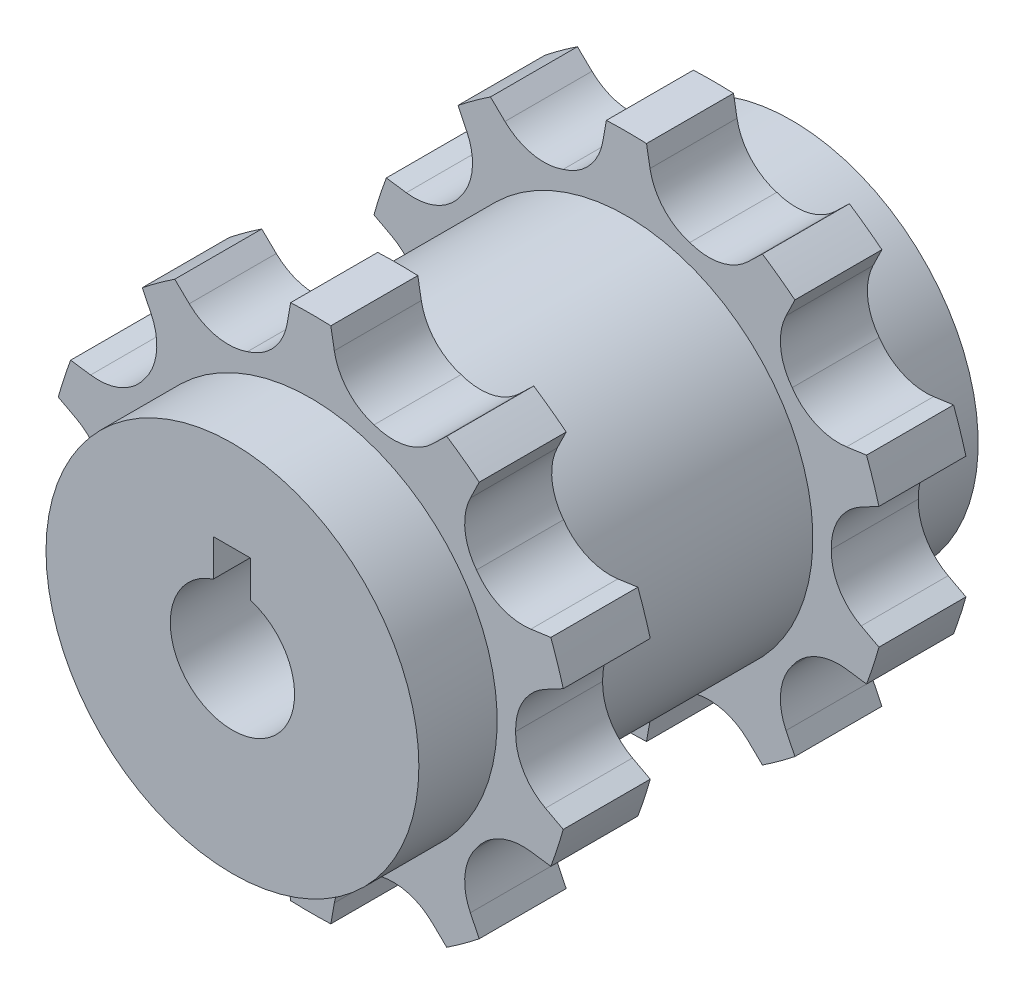
from build123d import *

# Parameters (mm, degrees)
EXTRUDE_1_DEPTH     = 7
SKETCH_2_R          = 15
EXTRUDE_2_DEPTH     = 18.4
EXTRUDE_3_DEPTH     = 7
EXTRUDE_START       = 6.3
SKETCH_4_R          = 15
EXTRUDE_4_DEPTH     = 6.3
SKETCH_5_R          = 15
EXTRUDE_5_DEPTH     = 6.3
CUT_EXTRUDE_1_DEPTH = 90.291681756


with BuildPart() as part:
    # 草图1 → 凸台-拉伸1 (new body)
    with BuildSketch(Plane.XY.offset(28.9)):
        with BuildLine():
            Line((42.411201909, 45.77806603), (42.129389286, 47.376304833))
            ThreePointArc((42.129389286, 47.376304833), (40.514502568, 47.409839327), (38.89961585, 47.376304833))
            Line((38.89961585, 47.376304833), (38.617803227, 45.77806603))
            ThreePointArc((38.617803227, 45.77806603), (37.528159676, 43.541003491), (35.420005537, 42.219088972))
            ThreePointArc((35.420005537, 42.219088972), (32.937471152, 42.04939837), (30.741018632, 43.218743572))
            Line((30.741018632, 43.218743572), (29.573606233, 44.346100621))
            ThreePointArc((29.573606233, 44.346100621), (28.247424353, 43.424024), (26.960664635, 42.447687427))
            Line((26.960664635, 42.447687427), (27.672094632, 40.98903977))
            ThreePointArc((27.672094632, 40.98903977), (28.10546685, 38.538741749), (27.176936184, 36.230148526))
            ThreePointArc((27.176936184, 36.230148526), (25.268265311, 34.633668845), (22.80397403, 34.288646587))
            Line((22.80397403, 34.288646587), (21.196873713, 34.514509808))
            ThreePointArc((21.196873713, 34.514509808), (20.665953073, 32.989024), (20.198818833, 31.442812735))
            Line((20.198818833, 31.442812735), (21.631749371, 30.680910052))
            ThreePointArc((21.631749371, 30.680910052), (23.422603901, 28.95330711), (24.028363863, 26.539839327))
            ThreePointArc((24.028363863, 26.539839327), (23.422603901, 24.126371544), (21.631749371, 22.398768602))
            Line((21.631749371, 22.398768602), (20.198818833, 21.63686592))
            ThreePointArc((20.198818833, 21.63686592), (20.665953073, 20.090654655), (21.196873713, 18.565168847))
            Line((21.196873713, 18.565168847), (22.80397403, 18.791032067))
            ThreePointArc((22.80397403, 18.791032067), (25.268265311, 18.446009809), (27.176936184, 16.849530129))
            ThreePointArc((27.176936184, 16.849530129), (28.10546685, 14.540936905), (27.672094632, 12.090638884))
            Line((27.672094632, 12.090638884), (26.960664635, 10.631991228))
            ThreePointArc((26.960664635, 10.631991228), (28.247424353, 9.655654655), (29.573606233, 8.733578033))
            Line((29.573606233, 8.733578033), (30.741018632, 9.860935083))
            ThreePointArc((30.741018632, 9.860935083), (32.937471152, 11.030280285), (35.420005536, 10.860589683))
            ThreePointArc((35.420005536, 10.860589683), (37.528159676, 9.538675164), (38.617803227, 7.301612625))
            Line((38.617803227, 7.301612625), (38.89961585, 5.703373822))
            ThreePointArc((38.89961585, 5.703373822), (40.514502568, 5.669839327), (42.129389286, 5.703373822))
            Line((42.129389286, 5.703373822), (42.411201909, 7.301612625))
            ThreePointArc((42.411201909, 7.301612625), (43.50084546, 9.538675164), (45.6089996, 10.860589683))
            ThreePointArc((45.6089996, 10.860589683), (48.091533984, 11.030280285), (50.287986504, 9.860935083))
            Line((50.287986504, 9.860935083), (51.455398903, 8.733578033))
            ThreePointArc((51.455398903, 8.733578033), (52.781580783, 9.655654655), (54.068340501, 10.631991228))
            Line((54.068340501, 10.631991228), (53.356910504, 12.090638884))
            ThreePointArc((53.356910504, 12.090638884), (52.923538286, 14.540936905), (53.852068952, 16.849530129))
            ThreePointArc((53.852068952, 16.849530129), (55.760739826, 18.446009809), (58.225031106, 18.791032067))
            Line((58.225031106, 18.791032067), (59.832131424, 18.565168847))
            ThreePointArc((59.832131424, 18.565168847), (60.363052063, 20.090654655), (60.830186304, 21.63686592))
            Line((60.830186304, 21.63686592), (59.397255765, 22.398768602))
            ThreePointArc((59.397255765, 22.398768602), (57.606401235, 24.126371544), (57.000641274, 26.539839327))
            ThreePointArc((57.000641274, 26.539839327), (57.606401235, 28.95330711), (59.397255765, 30.680910052))
            Line((59.397255765, 30.680910052), (60.830186304, 31.442812735))
            ThreePointArc((60.830186304, 31.442812735), (60.363052063, 32.989024), (59.832131424, 34.514509808))
            Line((59.832131424, 34.514509808), (58.225031106, 34.288646587))
            ThreePointArc((58.225031106, 34.288646587), (55.760739826, 34.633668845), (53.852068952, 36.230148526))
            ThreePointArc((53.852068952, 36.230148526), (52.923538286, 38.538741749), (53.356910504, 40.98903977))
            Line((53.356910504, 40.98903977), (54.068340501, 42.447687427))
            ThreePointArc((54.068340501, 42.447687427), (52.781580783, 43.424024), (51.455398903, 44.346100621))
            Line((51.455398903, 44.346100621), (50.287986504, 43.218743572))
            ThreePointArc((50.287986504, 43.218743572), (48.091533984, 42.04939837), (45.6089996, 42.219088972))
            ThreePointArc((45.6089996, 42.219088972), (43.50084546, 43.541003491), (42.411201909, 45.77806603))
        make_face()
    extrude(amount=-EXTRUDE_1_DEPTH)

    # 草图2 → 凸台-拉伸2 (add)
    with BuildSketch(Plane(origin=(0, 0, 21.9), x_dir=(-1, 0, 0), z_dir=(0, 0, -1))):
        with Locations((-40.514502568, 26.539839327)):
            Circle(SKETCH_2_R)
    extrude(amount=EXTRUDE_2_DEPTH)

    # 草图3 → 凸台-拉伸3 (add)
    with BuildSketch(Plane.XY.offset(3.5)):
        with BuildLine():
            Line((42.411201909, 45.77806603), (42.129389286, 47.376304833))
            ThreePointArc((42.129389286, 47.376304833), (40.514502568, 47.409839327), (38.89961585, 47.376304833))
            Line((38.89961585, 47.376304833), (38.617803227, 45.77806603))
            ThreePointArc((38.617803227, 45.77806603), (37.528159676, 43.541003491), (35.420005537, 42.219088972))
            ThreePointArc((35.420005537, 42.219088972), (32.937471152, 42.04939837), (30.741018632, 43.218743572))
            Line((30.741018632, 43.218743572), (29.573606233, 44.346100621))
            ThreePointArc((29.573606233, 44.346100621), (28.247424353, 43.424024), (26.960664635, 42.447687427))
            Line((26.960664635, 42.447687427), (27.672094632, 40.98903977))
            ThreePointArc((27.672094632, 40.98903977), (28.10546685, 38.538741749), (27.176936184, 36.230148526))
            ThreePointArc((27.176936184, 36.230148526), (25.268265311, 34.633668845), (22.80397403, 34.288646587))
            Line((22.80397403, 34.288646587), (21.196873713, 34.514509808))
            ThreePointArc((21.196873713, 34.514509808), (20.665953073, 32.989024), (20.198818833, 31.442812735))
            Line((20.198818833, 31.442812735), (21.631749371, 30.680910052))
            ThreePointArc((21.631749371, 30.680910052), (23.422603901, 28.95330711), (24.028363863, 26.539839327))
            ThreePointArc((24.028363863, 26.539839327), (23.422603901, 24.126371544), (21.631749371, 22.398768602))
            Line((21.631749371, 22.398768602), (20.198818833, 21.63686592))
            ThreePointArc((20.198818833, 21.63686592), (20.665953073, 20.090654655), (21.196873713, 18.565168847))
            Line((21.196873713, 18.565168847), (22.80397403, 18.791032067))
            ThreePointArc((22.80397403, 18.791032067), (25.268265311, 18.446009809), (27.176936184, 16.849530129))
            ThreePointArc((27.176936184, 16.849530129), (28.10546685, 14.540936905), (27.672094632, 12.090638884))
            Line((27.672094632, 12.090638884), (26.960664635, 10.631991228))
            ThreePointArc((26.960664635, 10.631991228), (28.247424353, 9.655654655), (29.573606233, 8.733578033))
            Line((29.573606233, 8.733578033), (30.741018632, 9.860935083))
            ThreePointArc((30.741018632, 9.860935083), (32.937471152, 11.030280285), (35.420005536, 10.860589683))
            ThreePointArc((35.420005536, 10.860589683), (37.528159676, 9.538675164), (38.617803227, 7.301612625))
            Line((38.617803227, 7.301612625), (38.89961585, 5.703373822))
            ThreePointArc((38.89961585, 5.703373822), (40.514502568, 5.669839327), (42.129389286, 5.703373822))
            Line((42.129389286, 5.703373822), (42.411201909, 7.301612625))
            ThreePointArc((42.411201909, 7.301612625), (43.50084546, 9.538675164), (45.6089996, 10.860589683))
            ThreePointArc((45.6089996, 10.860589683), (48.091533984, 11.030280285), (50.287986504, 9.860935083))
            Line((50.287986504, 9.860935083), (51.455398903, 8.733578033))
            ThreePointArc((51.455398903, 8.733578033), (52.781580783, 9.655654655), (54.068340501, 10.631991228))
            Line((54.068340501, 10.631991228), (53.356910504, 12.090638884))
            ThreePointArc((53.356910504, 12.090638884), (52.923538286, 14.540936905), (53.852068952, 16.849530129))
            ThreePointArc((53.852068952, 16.849530129), (55.760739826, 18.446009809), (58.225031106, 18.791032067))
            Line((58.225031106, 18.791032067), (59.832131424, 18.565168847))
            ThreePointArc((59.832131424, 18.565168847), (60.363052063, 20.090654655), (60.830186304, 21.63686592))
            Line((60.830186304, 21.63686592), (59.397255765, 22.398768602))
            ThreePointArc((59.397255765, 22.398768602), (57.606401235, 24.126371544), (57.000641274, 26.539839327))
            ThreePointArc((57.000641274, 26.539839327), (57.606401235, 28.95330711), (59.397255765, 30.680910052))
            Line((59.397255765, 30.680910052), (60.830186304, 31.442812735))
            ThreePointArc((60.830186304, 31.442812735), (60.363052063, 32.989024), (59.832131424, 34.514509808))
            Line((59.832131424, 34.514509808), (58.225031106, 34.288646587))
            ThreePointArc((58.225031106, 34.288646587), (55.760739826, 34.633668845), (53.852068952, 36.230148526))
            ThreePointArc((53.852068952, 36.230148526), (52.923538286, 38.538741749), (53.356910504, 40.98903977))
            Line((53.356910504, 40.98903977), (54.068340501, 42.447687427))
            ThreePointArc((54.068340501, 42.447687427), (52.781580783, 43.424024), (51.455398903, 44.346100621))
            Line((51.455398903, 44.346100621), (50.287986504, 43.218743572))
            ThreePointArc((50.287986504, 43.218743572), (48.091533984, 42.04939837), (45.6089996, 42.219088972))
            ThreePointArc((45.6089996, 42.219088972), (43.50084546, 43.541003491), (42.411201909, 45.77806603))
        make_face()
    extrude(amount=-EXTRUDE_3_DEPTH)

    # 草图4 → 凸台-拉伸4 (add)
    with BuildSketch(Plane.XY.offset(28.9).offset(EXTRUDE_START)):
        with Locations(Location((40.514502568, 26.539839327, 0), (0, 0, 180))):
            Circle(SKETCH_4_R)
    extrude(amount=-EXTRUDE_4_DEPTH)

    # 草图5 → 凸台-拉伸5 (add)
    with BuildSketch(Plane(origin=(0, 0, -3.5), x_dir=(-1, 0, 0), z_dir=(0, 0, -1))):
        with Locations((-40.514502568, 26.539839327)):
            Circle(SKETCH_5_R)
    extrude(amount=EXTRUDE_5_DEPTH)

    # 草图6 → 切除-拉伸1 (cut, through all)
    with BuildSketch(Plane(origin=(0, 0, -9.8), x_dir=(-1, 0, 0), z_dir=(0, 0, -1))):
        with BuildLine():
            Line((-38.971830845, 31.295905344), (-38.971830845, 34.262802089))
            Line((-38.971830845, 34.262802089), (-41.953176795, 34.262802089))
            Line((-41.953176795, 34.262802089), (-41.953176795, 31.328389888))
            ThreePointArc((-41.953176795, 31.328389888), (-40.568978996, 21.540136104), (-38.971830845, 31.295905344))
        make_face()
    extrude(amount=-CUT_EXTRUDE_1_DEPTH, mode=Mode.SUBTRACT)


solid = part.part
